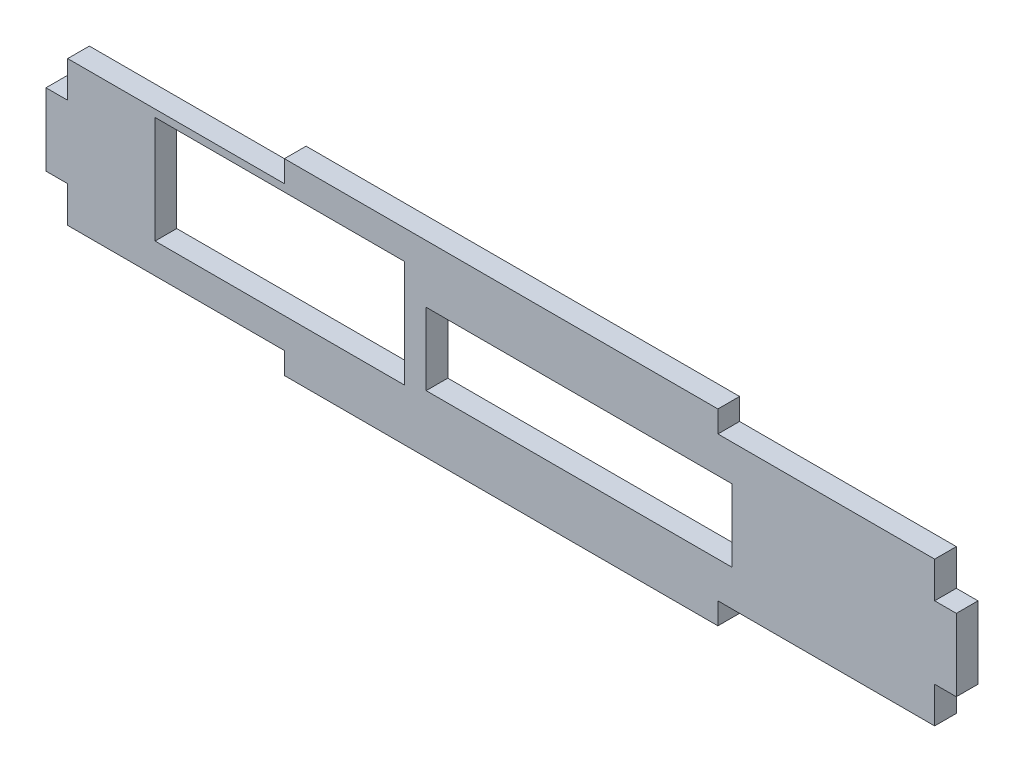
from build123d import *

# Parameters (mm, degrees)
SKETCH1_W           = 34.539950858
SKETCH1_H           = 14.819505943
SKETCH1_W_2         = 42.327470122
SKETCH1_H_2         = 10
BOSS_EXTRUDE1_DEPTH = 3


with BuildPart() as part:
    # Sketch1 → Boss-Extrude1 (new body)
    with BuildSketch(Plane.XY):
        Polygon((0, 0), (0, 5), (-3, 5), (-3, 15), (0, 15), (0, 20), (30, 20), (30, 23), (90, 23), (90, 20), (120, 20), (120, 15), (123, 15), (123, 5), (120, 5), (120, 0), (90, 0), (90, -3), (30, -3), (30, 0), align=None)
        with Locations((29.364361229, 11.580788204)):
            Rectangle(SKETCH1_W, SKETCH1_H, mode=Mode.SUBTRACT)
        with Locations((70.779364133, 10)):
            Rectangle(SKETCH1_W_2, SKETCH1_H_2, mode=Mode.SUBTRACT)
    extrude(amount=BOSS_EXTRUDE1_DEPTH)


solid = part.part
